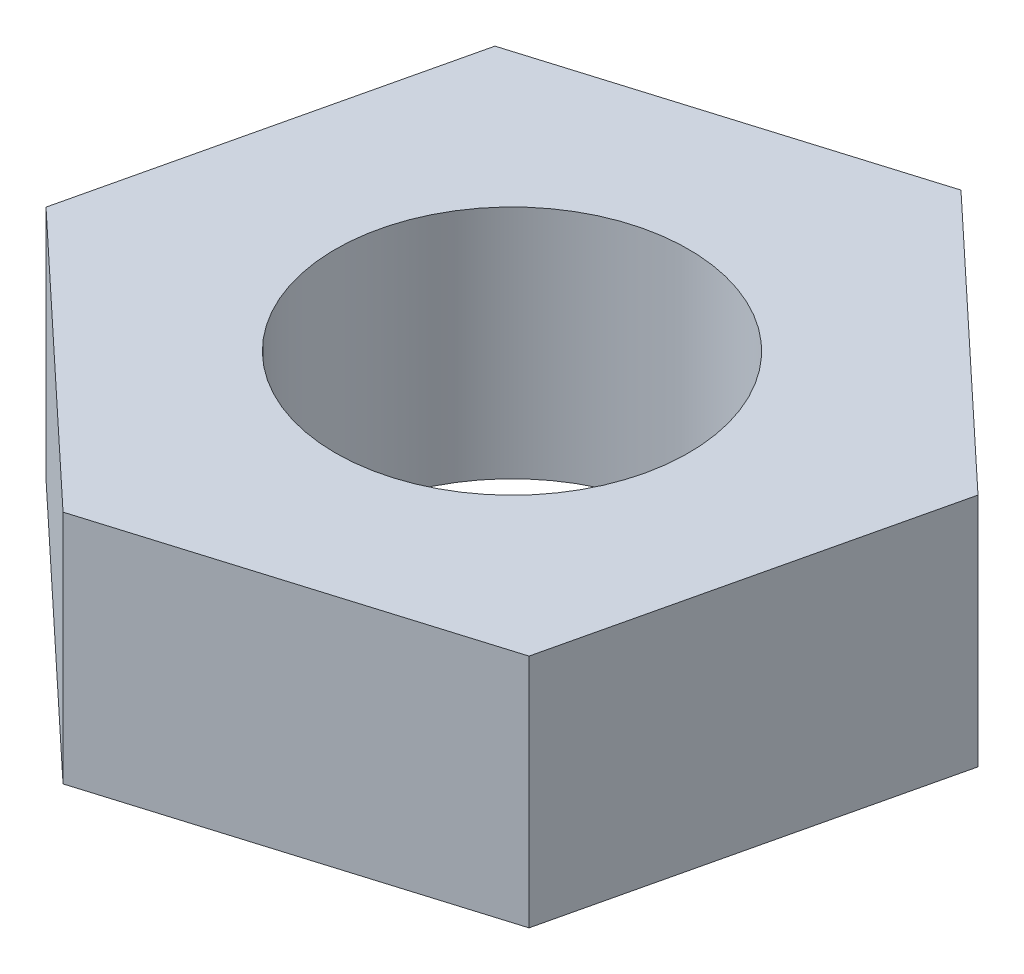
from build123d import *

# Parameters (mm, degrees)
SKETCH1_R           = 1.5
BOSS_EXTRUDE1_DEPTH = 2


with BuildPart() as part:
    # Sketch1 → Boss-Extrude1 (new body)
    with BuildSketch(Plane(origin=(0, 0, 0), x_dir=(1, 0, 0), z_dir=(0, 1, 0))):
        Polygon((2.316591757, -2.171804772), (3.039133983, 0.920324925), (0.722542226, 3.092129697), (-2.316591757, 2.171804772), (-3.039133983, -0.920324925), (-0.722542226, -3.092129697), align=None)
        with Locations(Location((0, 0, 0), (0, 0, 270))):
            Circle(SKETCH1_R, mode=Mode.SUBTRACT)
    extrude(amount=BOSS_EXTRUDE1_DEPTH)


solid = part.part
